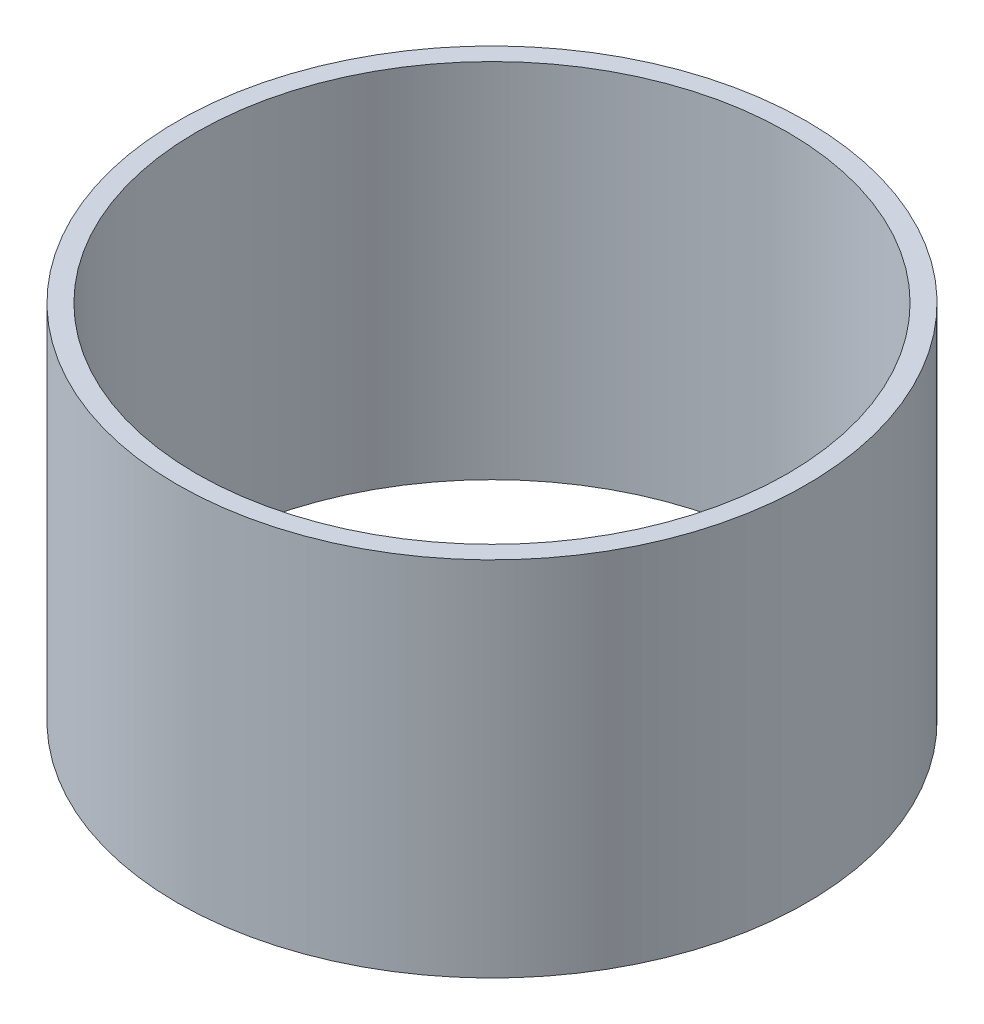
from build123d import *

# Parameters (mm, degrees)
SKETCH1_R           = 11.0375
SKETCH1_R_2         = 10.36875
BOSS_EXTRUDE1_DEPTH = 12.7


with BuildPart() as part:
    # Sketch1 → Boss-Extrude1 (new body)
    with BuildSketch(Plane(origin=(0, 0, 0), x_dir=(1, 0, 0), z_dir=(0, 1, 0))):
        with Locations(Location((0, 0, 0), (0, 0, 270))):
            Circle(SKETCH1_R)
        with Locations(Location((0, 0, 0), (0, 0, 270))):
            Circle(SKETCH1_R_2, mode=Mode.SUBTRACT)
    extrude(amount=BOSS_EXTRUDE1_DEPTH)


solid = part.part
